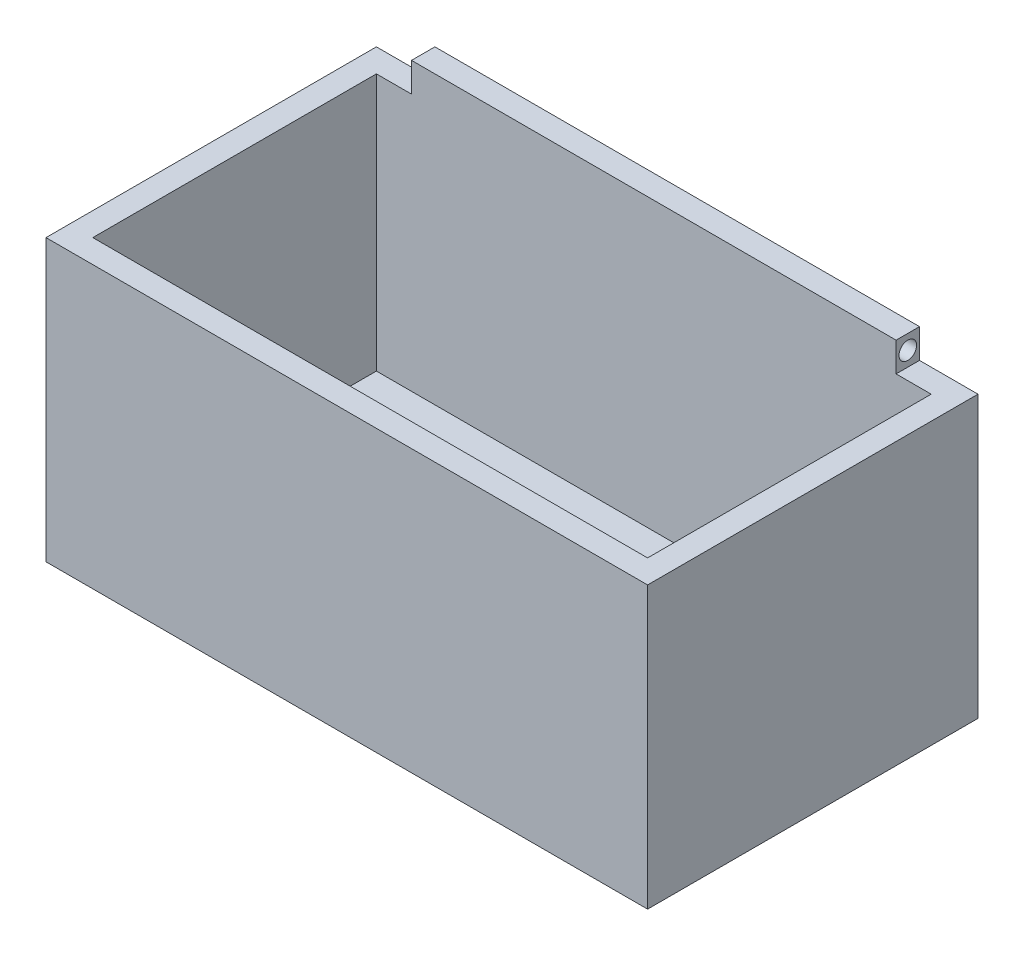
from build123d import *

# Parameters (mm, degrees)
SKETCH1_W           = 653.034
SKETCH1_H           = 304.8
BOSS_EXTRUDE1_DEPTH = 358.648
SHELL1_T            = -25.4
SKETCH2_W           = 526.034
SKETCH2_H           = 25.4
BOSS_EXTRUDE2_DEPTH = 31.75
SKETCH5_R           = 9.525
CUT_EXTRUDE2_DEPTH  = 25.4


with BuildPart() as part:
    # Sketch1 → Boss-Extrude1 (new body)
    with BuildSketch(Plane.XY):
        Rectangle(SKETCH1_W, SKETCH1_H)
    extrude(amount=BOSS_EXTRUDE1_DEPTH)

    # Shell1
    shell1_openings = [part.faces().sort_by_distance(p)[0] for p in [
        (0, 152.4, 179.324),
    ]]
    offset(amount=SHELL1_T, openings=shell1_openings, kind=Kind.INTERSECTION)

    # Sketch2 → Boss-Extrude2 (add)
    with BuildSketch(Plane(origin=(0, 152.4, 0), x_dir=(1, 0, 0), z_dir=(0, 1, 0))):
        with Locations((0, -12.7)):
            Rectangle(SKETCH2_W, SKETCH2_H)
    extrude(amount=BOSS_EXTRUDE2_DEPTH)

    # Sketch5 → Cut-Extrude2 (cut)
    with BuildSketch(Plane(origin=(263.017, 0, 0), x_dir=(0, 0, -1), z_dir=(1, 0, 0))):
        with Locations((-12.7, 168.275)):
            Circle(SKETCH5_R)
    cut_extrude2 = extrude(amount=-CUT_EXTRUDE2_DEPTH, mode=Mode.SUBTRACT)

    # Mirror2: Cut-Extrude2 across plane
    add(cut_extrude2.mirror(Plane(origin=(0, 0, 0), x_dir=(0, 0, 1), z_dir=(1, 0, 0))), mode=Mode.SUBTRACT)


solid = part.part
